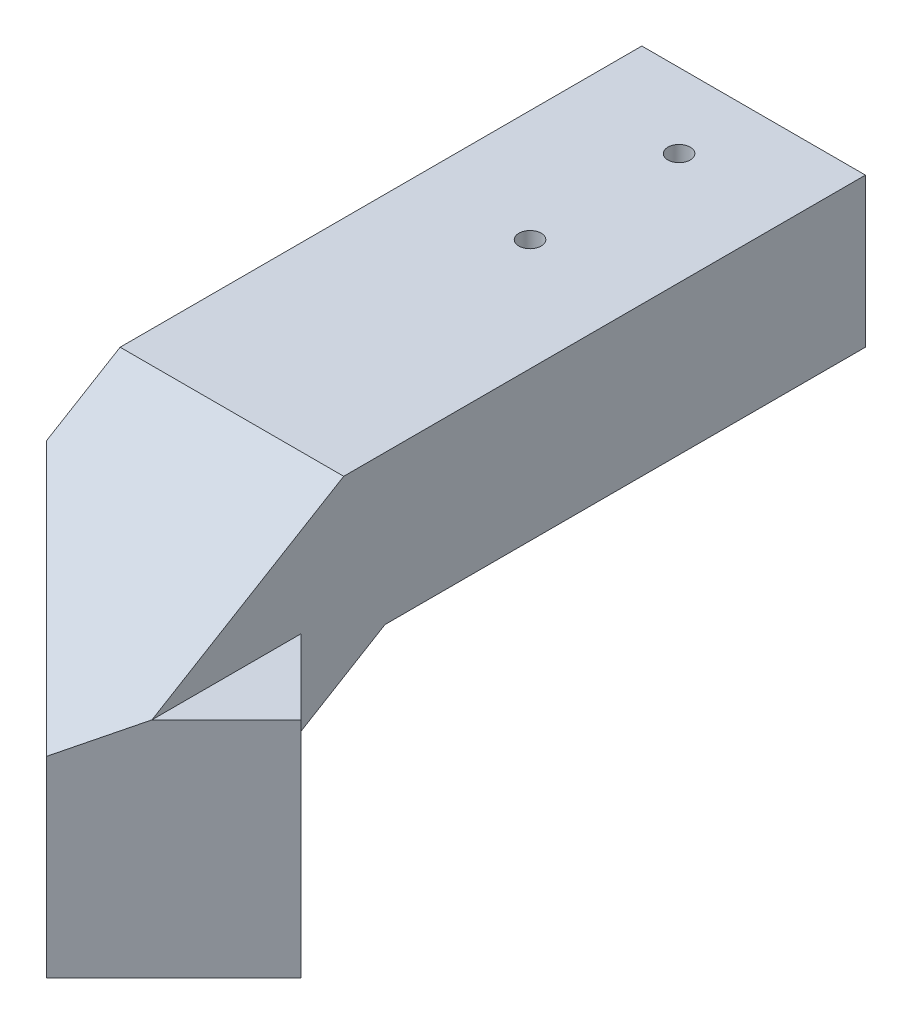
from build123d import *

# Parameters (mm, degrees)
SALIENTE_EXTRUIR2_DEPTH = 30
CROQUIS3_W              = 60.629420227
CROQUIS3_H              = 60.965705304
CORTAR_EXTRUIR1_DEPTH   = 30
CROQUIS4_R              = 3
CORTAR_EXTRUIR2_DEPTH   = 88.482529848
CROQUIS5_W              = 28.284271248
CROQUIS5_H              = 30
SALIENTE_EXTRUIR3_DEPTH = 14.142136
SALIENTE_EXTRUIR4_DEPTH = 10
CROQUIS7_W              = 23.581736244
CROQUIS7_H              = 30.206171788
CORTAR_EXTRUIR3_DEPTH   = 60
CROQUIS8_R              = 3
CORTAR_EXTRUIR4_DEPTH   = 99.7393004
CROQUIS10_W             = 79.072347139
CROQUIS10_H             = 56.401254602
CORTAR_EXTRUIR5_DEPTH   = 50
CROQUIS12_W             = 30
CROQUIS12_H             = 20
SALIENTE_EXTRUIR6_DEPTH = 20
CROQUIS13_R             = 1.5
CORTAR_EXTRUIR6_DEPTH   = 20


with BuildPart() as part:
    # Croquis2 → Saliente-Extruir2 (new body)
    with BuildSketch(Plane(origin=(0, 0, 0), x_dir=(0, 0, -1), z_dir=(1, 0, 0))):
        Polygon((0, 0), (-50, 0), (-75.724787771, -15.434872663), (-75.724787771, -45.434872663), (-55.724787771, -45.434872663), (-55.724787771, -26.758680242), (-44.460320701, -20), (0, -20), align=None)
    extrude(amount=SALIENTE_EXTRUIR2_DEPTH)

    # Croquis3 → Cortar-Extruir1 (cut)
    with BuildSketch(Plane(origin=(-22.862393886, 0, 22.862393886), x_dir=(0.7071067811865462, 0, 0.7071067811865488), z_dir=(-0.7071067811865488, 0, 0.7071067811865462))):
        with Locations((51.516510193, -19.86952732)):
            Rectangle(CROQUIS3_W, CROQUIS3_H)
    extrude(amount=CORTAR_EXTRUIR1_DEPTH, mode=Mode.SUBTRACT)

    # Croquis4 → Cortar-Extruir2 (cut, through all)
    with BuildSketch(Plane(origin=(-22.862393886, 0, 22.862393886), x_dir=(0.7071067811865461, 0, 0.7071067811865489), z_dir=(-0.7071067811865489, 0, 0.7071067811865461))):
        with Locations((60.616578749, -34.226076292)):
            Circle(CROQUIS4_R)
    extrude(amount=-CORTAR_EXTRUIR2_DEPTH, mode=Mode.SUBTRACT)

    # Croquis5 → Saliente-Extruir3 (add)
    with BuildSketch(Plane(origin=(-22.862393886, 0, 22.862393886), x_dir=(0.7071067811865461, 0, 0.7071067811865489), z_dir=(-0.7071067811865489, 0, 0.7071067811865461))):
        with Locations((60.616578749, -30.434872663)):
            Rectangle(CROQUIS5_W, CROQUIS5_H)
    extrude(amount=-SALIENTE_EXTRUIR3_DEPTH)

    # Croquis6 → Saliente-Extruir4 (add)
    with BuildSketch(Plane(origin=(-22.862393886, 0, 22.862393886), x_dir=(0.7071067811865461, 0, 0.7071067811865489), z_dir=(-0.7071067811865489, 0, 0.7071067811865461))):
        Polygon((32.332307501, -20.758680242), (46.474443125, -26.758680242), (46.474443125, -45.434872663), (74.758714373, -45.434872663), (74.758714373, -15.434872663), (38.378370617, 0), (32.332307501, 0), align=None)
    extrude(amount=SALIENTE_EXTRUIR4_DEPTH)

    # Croquis7 → Cortar-Extruir3 (cut)
    with BuildSketch(Plane(origin=(0, 0, 0), x_dir=(1, 0, 0), z_dir=(0, 1, 0))):
        with Locations((-11.790868122, -58.05803285)):
            Rectangle(CROQUIS7_W, CROQUIS7_H)
    extrude(amount=-CORTAR_EXTRUIR3_DEPTH, mode=Mode.SUBTRACT)

    # Croquis8 → Cortar-Extruir4 (cut, through all)
    with BuildSketch(Plane(origin=(-29.933461698, 0, 29.933461698), x_dir=(0.707106781186546, 0, 0.7071067811865491), z_dir=(-0.7071067811865491, 0, 0.707106781186546))):
        with Locations((60.616578749, -35.434872663)):
            Circle(CROQUIS8_R)
    extrude(amount=-CORTAR_EXTRUIR4_DEPTH, mode=Mode.SUBTRACT)

    # Croquis10 → Cortar-Extruir5 (cut)
    with BuildSketch(Plane(origin=(0, 22.058823529, 13.235294118), x_dir=(1, 0, 0), z_dir=(0, 0.8574929257125444, 0.5144957554275262))):
        with Locations((7.523719949, -68.590647859)):
            Rectangle(CROQUIS10_W, CROQUIS10_H)
    extrude(amount=CORTAR_EXTRUIR5_DEPTH, mode=Mode.SUBTRACT)

    # Croquis12 → Saliente-Extruir6 (add)
    with BuildSketch(Plane(origin=(0, 0, 0), x_dir=(-1, 0, 0), z_dir=(0, 0, -1))):
        with Locations((-15, -10)):
            Rectangle(CROQUIS12_W, CROQUIS12_H)
    extrude(amount=SALIENTE_EXTRUIR6_DEPTH)

    # Croquis13 → Cortar-Extruir6 (cut)
    with BuildSketch(Plane.XZ.offset(20)):
        with Locations(Location((15, -10, 0), (0, 0, 270))):
            Circle(CROQUIS13_R)
        with Locations(Location((15, 10, 0), (0, 0, 270))):
            Circle(CROQUIS13_R)
    extrude(amount=-CORTAR_EXTRUIR6_DEPTH, mode=Mode.SUBTRACT)


solid = part.part
